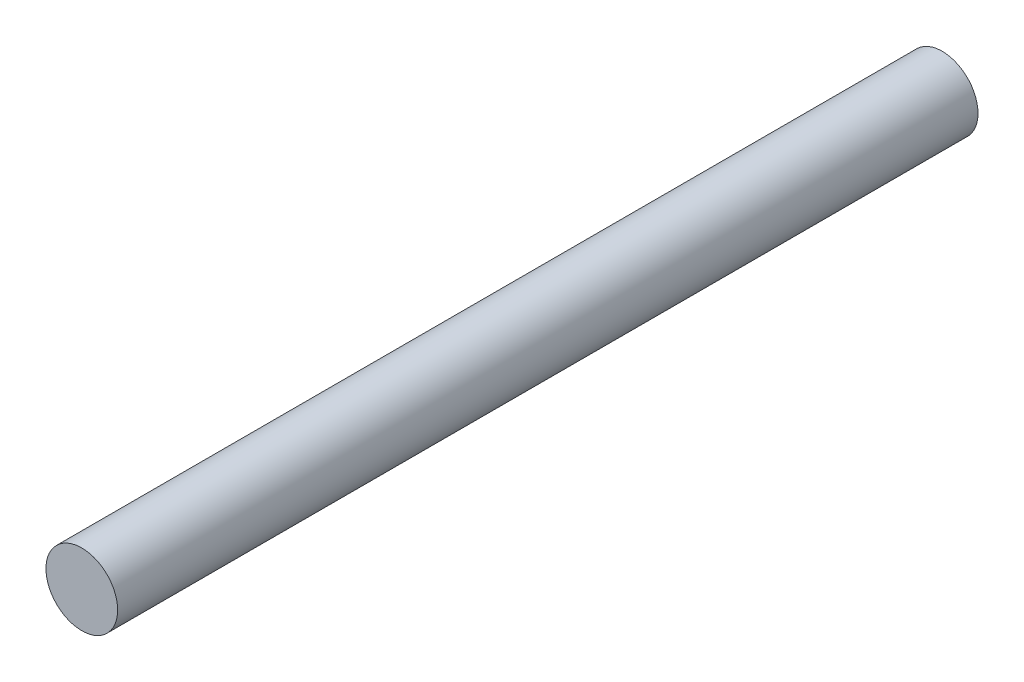
from build123d import *

# Parameters (mm, degrees)
ESQUISSE1_R        = 2.5
BOSS_EXTRU_1_DEPTH = 60


with BuildPart() as part:
    # Esquisse1 → Boss.-Extru.1 (new body)
    with BuildSketch(Plane.XY):
        Circle(ESQUISSE1_R)
    extrude(amount=BOSS_EXTRU_1_DEPTH)


solid = part.part
